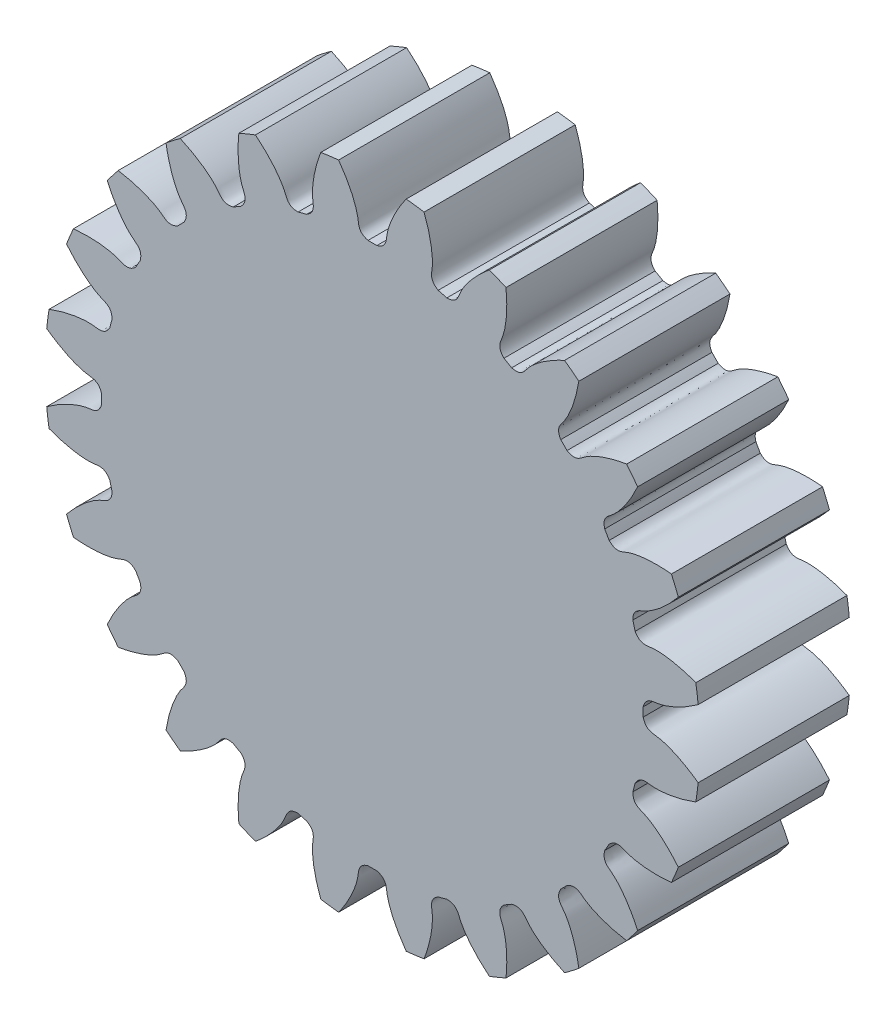
from build123d import *

# Parameters (mm, degrees)
SKETCH_1_R               = 6.5
EXTRUDE_1_DEPTH          = 3
CUT_EXTRUDE_1_DEPTH      = 10.669539803
PATTERN_CIRCULAR_1_COUNT = 24


with BuildPart() as part:
    # 草图1 → 凸台-拉伸1 (new body)
    with BuildSketch(Plane.XY):
        Circle(SKETCH_1_R)
    extrude(amount=EXTRUDE_1_DEPTH)

    # 草图2 → 切除-拉伸1 (cut, through all)
    with BuildSketch(Plane.XY):
        with BuildLine():
            ThreePointArc((0.088415956, 5.374272753), (0, 5.375), (-0.088415956, 5.374272753))
            add(Edge.make_bspline(
                [(-0.088415956, 5.374272753), (-0.283956108, 5.428430036), (-0.269523883, 5.557861799), (-0.293138588, 5.686342226), (-0.296517959, 5.702916521), (-0.300724242, 5.721620073), (-0.305840304, 5.742426358), (-0.311952817, 5.765305336), (-0.319146149, 5.790224685), (-0.327504211, 5.817149434), (-0.337109789, 5.846042111), (-0.348044663, 5.876862729), (-0.360389484, 5.909568827), (-0.374223721, 5.944115495), (-0.389625595, 5.980455405), (-0.406672011, 6.018538843), (-0.425438499, 6.058313744), (-0.445999145, 6.099725726), (-0.468426535, 6.142718129), (-0.492791687, 6.187232054), (-0.519163995, 6.233206399), (-0.547611171, 6.280577906), (-0.57819918, 6.329281201), (-0.610992189, 6.379248841), (-0.64605251, 6.430411359), (-0.68344054, 6.482697309), (-0.723214712, 6.53603332), (-0.765431443, 6.590344144), (-0.810145078, 6.645552705), (-0.857407842, 6.701580158), (-0.907269792, 6.758345935), (-0.959778768, 6.81576781), (-1.014980347, 6.873761948), (-1.0729178, 6.932242967), (-1.133632047, 6.991123994), (-1.197161611, 7.05031673), (-1.263542589, 7.109731505), (-1.332808587, 7.169277345), (-1.430211047, 7.249680778), (-1.505961903, 7.308439159), (-1.55780976, 7.347058965)],
                knots=[0, 0, 0, 0, 0.143961355, 0.149818462, 0.156576662, 0.164235955, 0.172796342, 0.182257821, 0.192620395, 0.203884061, 0.216048821, 0.229114674, 0.24308162, 0.25794966, 0.273718793, 0.290389019, 0.307960339, 0.326432751, 0.345806258, 0.366080857, 0.38725655, 0.409333336, 0.432311215, 0.456190188, 0.480970254, 0.506651413, 0.533233666, 0.560717012, 0.589101451, 0.618386984, 0.64857361, 0.679661329, 0.711650141, 0.744540047, 0.778331046, 0.813023138, 0.848616324, 0.885110603, 0.922505975, 1, 1, 1, 1], degree=3))
            ThreePointArc((-1.55780976, 7.347058965), (0, 7.510395907), (1.55780976, 7.347058965))
            add(Edge.make_bspline(
                [(0.088415956, 5.374272753), (0.283956108, 5.428430036), (0.269523883, 5.557861799), (0.293138588, 5.686342226), (0.296517959, 5.702916521), (0.300724242, 5.721620073), (0.305840304, 5.742426358), (0.311952817, 5.765305336), (0.319146149, 5.790224685), (0.327504211, 5.817149434), (0.337109789, 5.846042111), (0.348044663, 5.876862729), (0.360389484, 5.909568827), (0.374223721, 5.944115495), (0.389625595, 5.980455405), (0.406672011, 6.018538843), (0.425438499, 6.058313744), (0.445999145, 6.099725726), (0.468426535, 6.142718129), (0.492791687, 6.187232054), (0.519163995, 6.233206399), (0.547611171, 6.280577906), (0.57819918, 6.329281201), (0.610992189, 6.379248841), (0.64605251, 6.430411359), (0.68344054, 6.482697309), (0.723214712, 6.53603332), (0.765431443, 6.590344144), (0.810145078, 6.645552705), (0.857407842, 6.701580158), (0.907269792, 6.758345935), (0.959778768, 6.81576781), (1.014980347, 6.873761948), (1.0729178, 6.932242967), (1.133632047, 6.991123994), (1.197161611, 7.05031673), (1.263542589, 7.109731505), (1.332808587, 7.169277345), (1.430211047, 7.249680778), (1.505961903, 7.308439159), (1.55780976, 7.347058965)],
                knots=[0, 0, 0, 0, 0.143961355, 0.149818462, 0.156576662, 0.164235955, 0.172796342, 0.182257821, 0.192620395, 0.203884061, 0.216048821, 0.229114674, 0.24308162, 0.25794966, 0.273718793, 0.290389019, 0.307960339, 0.326432751, 0.345806258, 0.366080857, 0.38725655, 0.409333336, 0.432311215, 0.456190188, 0.480970254, 0.506651413, 0.533233666, 0.560717012, 0.589101451, 0.618386984, 0.64857361, 0.679661329, 0.711650141, 0.744540047, 0.778331046, 0.813023138, 0.848616324, 0.885110603, 0.922505975, 1, 1, 1, 1], degree=3))
        make_face()
    cut_extrude_1 = extrude(amount=CUT_EXTRUDE_1_DEPTH, mode=Mode.SUBTRACT)

    # 阵列(圆周)1: 切除-拉伸1 ×24 about axis
    pattern_circular_1_axis = Axis((0, 0, 3), (0, 0, -1))
    for i in range(1, PATTERN_CIRCULAR_1_COUNT):
        add(cut_extrude_1.rotate(pattern_circular_1_axis, i * 360 / PATTERN_CIRCULAR_1_COUNT), mode=Mode.SUBTRACT)


solid = part.part
